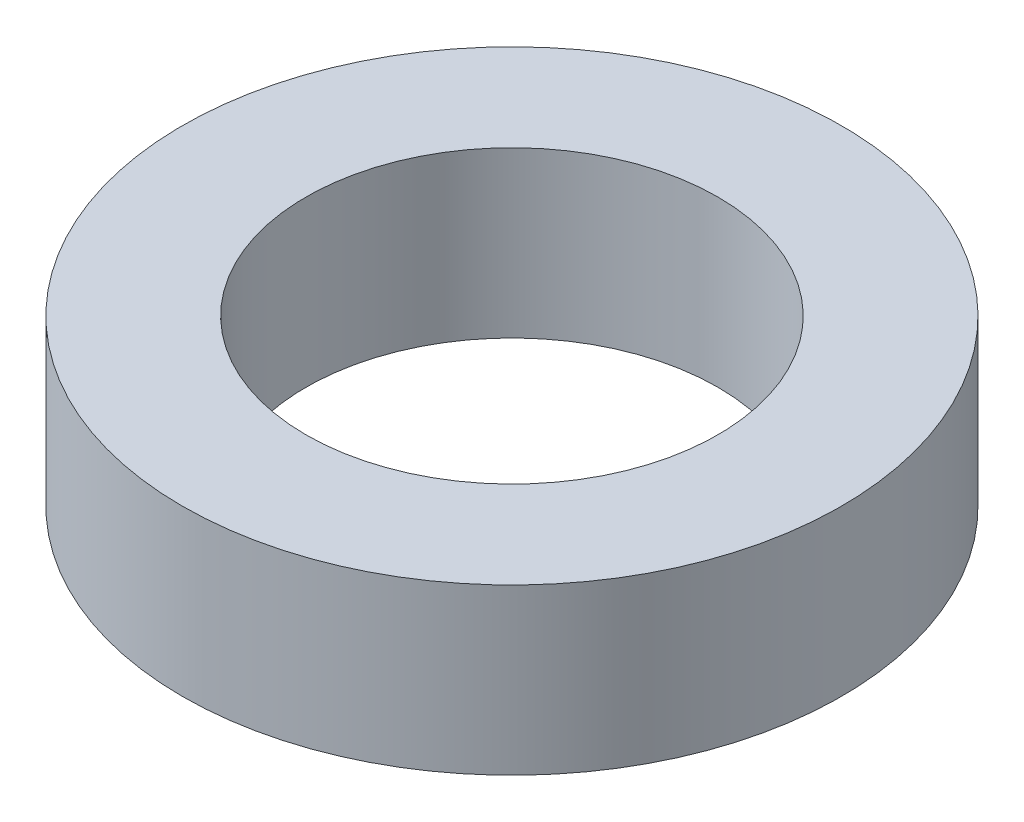
from build123d import *

# Parameters (mm, degrees)
SKETCH_1_R      = 8
SKETCH_1_R_2    = 5
EXTRUDE_1_DEPTH = 4


with BuildPart() as part:
    # 草图1 → 凸台-拉伸1 (new body)
    with BuildSketch(Plane(origin=(0, 0, 0), x_dir=(1, 0, 0), z_dir=(0, 1, 0))):
        with Locations(Location((0, 0, 0), (0, 0, 270))):
            Circle(SKETCH_1_R)
        with Locations(Location((0, 0, 0), (0, 0, 270))):
            Circle(SKETCH_1_R_2, mode=Mode.SUBTRACT)
    extrude(amount=EXTRUDE_1_DEPTH)


solid = part.part
